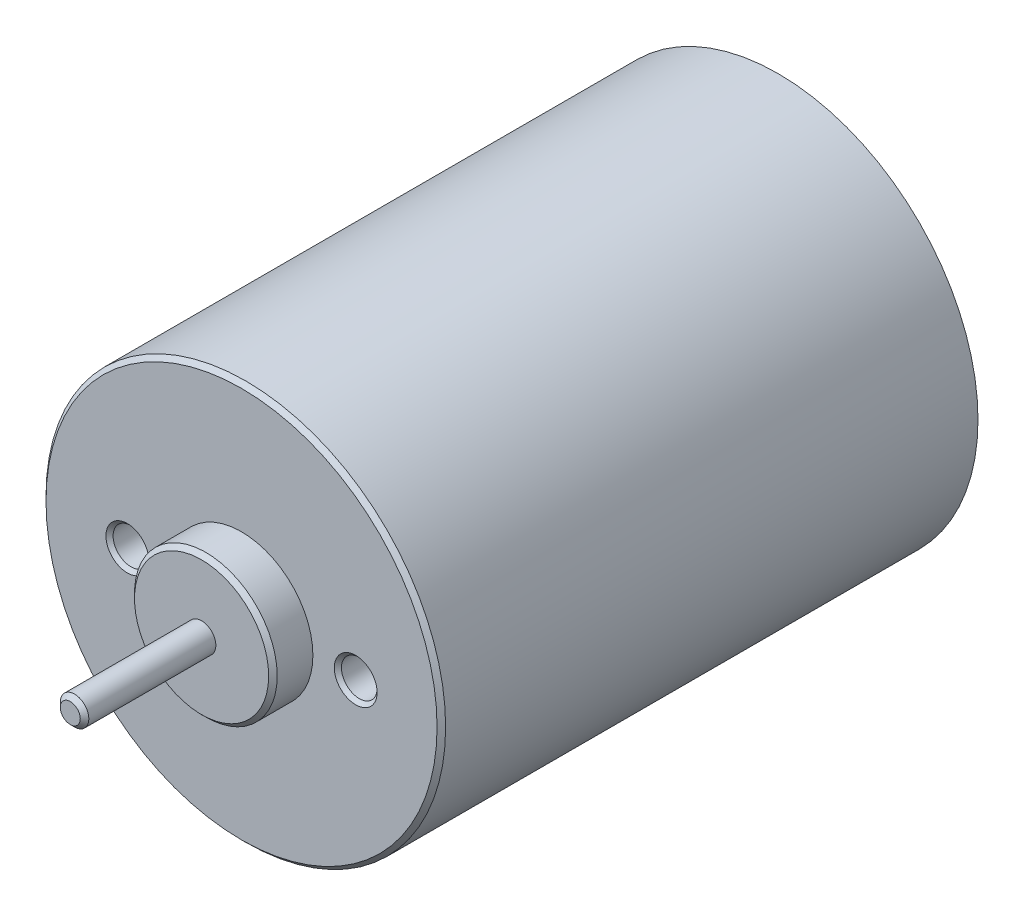
from build123d import *

# Parameters (mm, degrees)
SKETCH1_R           = 14
BOSS_EXTRUDE1_DEPTH = 37.6
SKETCH2_R           = 5
BOSS_EXTRUDE2_DEPTH = 2.8
SKETCH3_R           = 1
BOSS_EXTRUDE3_DEPTH = 9.2
BOSS_EXTRUDE4_START = 2.6
SKETCH4_R           = 5
BOSS_EXTRUDE4_DEPTH = 2.6
BOSS_EXTRUDE5_START = 1.4
SKETCH5_R           = 1
BOSS_EXTRUDE5_DEPTH = 1.4
CHAMFER1_SIZE       = 0.3
CHAMFER2_SIZE       = 0.3
SKETCH6_R           = 1.25
CUT_EXTRUDE1_DEPTH  = 2.5
CHAMFER3_SIZE       = 0.25


with BuildPart() as part:
    # Sketch1 → Boss-Extrude1 (new body)
    with BuildSketch(Plane.XY):
        Circle(SKETCH1_R)
    extrude(amount=BOSS_EXTRUDE1_DEPTH)

    # Sketch2 → Boss-Extrude2 (add)
    with BuildSketch(Plane.XY.offset(37.6)):
        Circle(SKETCH2_R)
    extrude(amount=BOSS_EXTRUDE2_DEPTH)

    # Sketch3 → Boss-Extrude3 (add)
    with BuildSketch(Plane.XY.offset(40.4)):
        Circle(SKETCH3_R)
    extrude(amount=BOSS_EXTRUDE3_DEPTH)

    # Sketch4 → Boss-Extrude4 (add)
    with BuildSketch(Plane(origin=(0, 0, 0), x_dir=(-1, 0, 0), z_dir=(0, 0, -1)).offset(BOSS_EXTRUDE4_START)):
        with Locations(Location((0, 0, 0), (0, 0, 180))):
            Circle(SKETCH4_R)
    extrude(amount=-BOSS_EXTRUDE4_DEPTH)

    # Sketch5 → Boss-Extrude5 (add)
    with BuildSketch(Plane(origin=(0, 0, -2.6), x_dir=(-1, 0, 0), z_dir=(0, 0, -1)).offset(BOSS_EXTRUDE5_START)):
        with Locations(Location((0, 0, 0), (0, 0, 180))):
            Circle(SKETCH5_R)
    extrude(amount=-BOSS_EXTRUDE5_DEPTH)

    # Chamfer1
    chamfer1_edges = [part.edges().sort_by_distance(p)[0] for p in [
        (-5, 0, -2.6),
        (-14, 0, 37.6),
        (-5, 0, 40.4),
    ]]
    chamfer(chamfer1_edges, length=CHAMFER1_SIZE)

    # Chamfer2
    chamfer2_edges = [part.edges().sort_by_distance(p)[0] for p in [
        (-1, 0, 49.6),
        (-1, 0, -4),
    ]]
    chamfer(chamfer2_edges, length=CHAMFER2_SIZE)

    # Sketch6 → Cut-Extrude1 (cut)
    with BuildSketch(Plane.XY.offset(37.6)):
        with Locations((-8, 0)):
            Circle(SKETCH6_R)
        with Locations((8, 0)):
            Circle(SKETCH6_R)
    extrude(amount=-CUT_EXTRUDE1_DEPTH, mode=Mode.SUBTRACT)

    # Chamfer3
    chamfer3_edges = [part.edges().sort_by_distance(p)[0] for p in [
        (-9.25, 0, 37.6),
        (6.75, 0, 37.6),
    ]]
    chamfer(chamfer3_edges, length=CHAMFER3_SIZE)


solid = part.part
